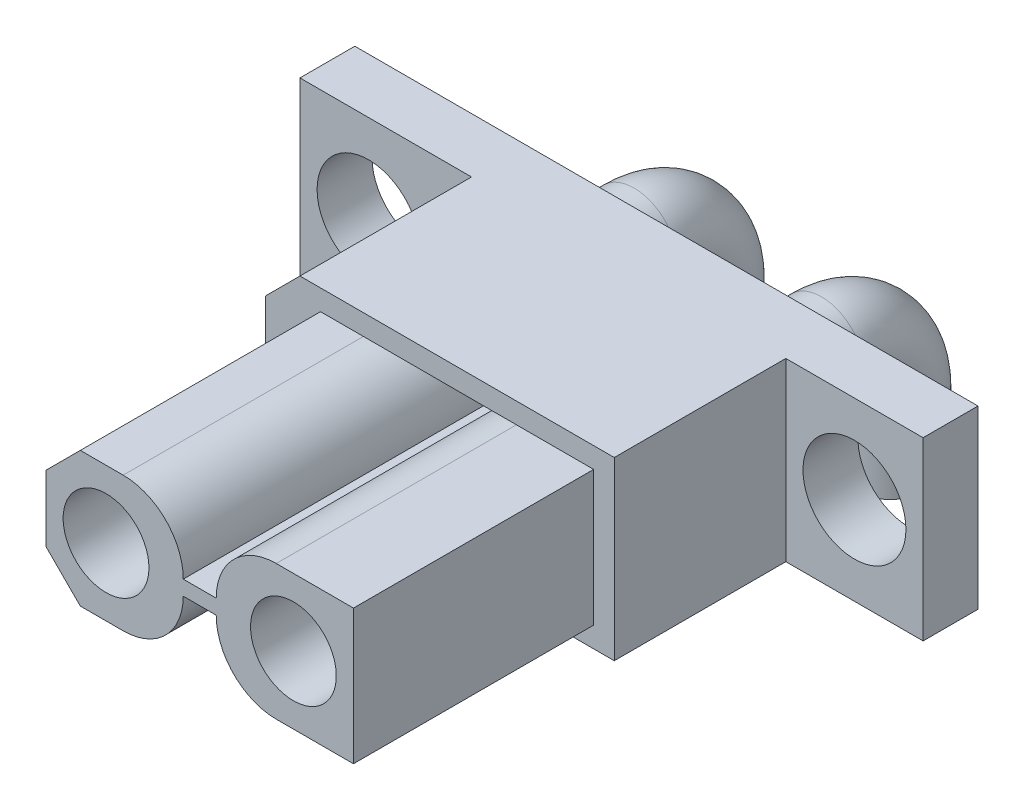
from build123d import *

# Parameters (mm, degrees)
EXTRUDE_1_DEPTH     = 5
EXTRUDE_2_DEPTH     = 9
SKETCH_12_R         = 1.25
CUT_EXTRUDE_3_DEPTH = 7
SKETCH_13_R         = 1.25
EXTRUDE_3_DEPTH     = 5.5
SKETCH_14_OUTSIDE_W = 15.846
SKETCH_14_OUTSIDE_H = 10.816
CUT_EXTRUDE_4_DEPTH = 2
EXTRUDE_4_DEPTH     = 0.2
SKETCH_16_W         = 18.16
SKETCH_16_H         = 5.13
EXTRUDE_5_DEPTH     = 1.6
SKETCH_17_R         = 1.5
CUT_EXTRUDE_5_DEPTH = 1.6
SKETCH_21_W         = 18.16
SKETCH_21_H         = 0.1
CUT_EXTRUDE_6_DEPTH = 19
SKETCH_22_R         = 1.25
SKETCH_22_R_2       = 1.264973269


with BuildPart() as part:
    # 草图1 → 凸台-拉伸1 (new body)
    with BuildSketch(Plane.XY):
        Polygon((-5.08, 1.565), (-4.08, 2.565), (5.08, 2.565), (5.08, -2.565), (-4.08, -2.565), (-5.08, -1.565), align=None)
        with BuildLine():
            Line((-2.58, 1.965), (4.48, 1.965))
            Line((4.48, 1.965), (4.48, -1.965))
            Line((4.48, -1.965), (-2.58, -1.965))
            ThreePointArc((-2.58, -1.965), (-3.923502884, -1.408502884), (-4.48, -0.065))
            Line((-4.48, -0.065), (-4.48, 0.065))
            ThreePointArc((-4.48, 0.065), (-3.923502884, 1.408502884), (-2.58, 1.965))
        make_face(mode=Mode.SUBTRACT)
    extrude(amount=EXTRUDE_1_DEPTH)

    # 草图11 → 凸台-拉伸2 (add)
    with BuildSketch(Plane.XY.offset(12)):
        with BuildLine():
            Line((4.48, 1.965), (2.23, 1.965))
            ThreePointArc((2.23, 1.965), (0.992563133, 1.452436867), (0.48, 0.215))
            Line((0.48, 0.215), (-0.48, 0.215))
            ThreePointArc((-0.48, 0.215), (-0.992563133, 1.452436867), (-2.23, 1.965))
            Line((-2.23, 1.965), (-3.48, 1.965))
            Line((-3.48, 1.965), (-4.48, 0.965))
            Line((-4.48, 0.965), (-4.48, -0.965))
            Line((-4.48, -0.965), (-3.48, -1.965))
            Line((-3.48, -1.965), (-2.23, -1.965))
            ThreePointArc((-2.23, -1.965), (-0.992563133, -1.452436867), (-0.48, -0.215))
            Line((-0.48, -0.215), (0.48, -0.215))
            ThreePointArc((0.48, -0.215), (0.992563133, -1.452436867), (2.23, -1.965))
            Line((2.23, -1.965), (4.48, -1.965))
            Line((4.48, -1.965), (4.48, 1.965))
        make_face()
    extrude(amount=-EXTRUDE_2_DEPTH)

    # 草图12 → 切除-拉伸3 (cut)
    with BuildSketch(Plane.XY.offset(12)):
        with Locations((-2.73, 0)):
            Circle(SKETCH_12_R)
        with Locations(Location((2.73, 0, 0), (0, 0, 180))):
            Circle(SKETCH_12_R)
    extrude(amount=-CUT_EXTRUDE_3_DEPTH, mode=Mode.SUBTRACT)

    # 草图13 → 凸台-拉伸3 (add)
    with BuildSketch(Plane(origin=(0, 0, 3), x_dir=(-1, 0, 0), z_dir=(0, 0, -1))):
        with Locations((-2.73, 0)):
            Circle(SKETCH_13_R)
        with Locations(Location((2.73, 0, 0), (0, 0, 180))):
            Circle(SKETCH_13_R)
    extrude(amount=EXTRUDE_3_DEPTH)

    # 草图14 outside → 切除-拉伸4 (cut)
    with BuildSketch(Plane(origin=(0, 0, -2.5), x_dir=(-1, 0, 0), z_dir=(0, 0, -1))):
        Rectangle(SKETCH_14_OUTSIDE_W, SKETCH_14_OUTSIDE_H)
        with BuildLine():
            Line((2.73, 1.25), (2.73, 1.05))
            ThreePointArc((2.73, 1.05), (1.68, 0), (2.73, -1.05))
            Line((2.73, -1.05), (2.73, -1.25))
            ThreePointArc((2.73, -1.25), (1.48, 0), (2.73, 1.25))
        make_face(mode=Mode.SUBTRACT)
        with BuildLine():
            Line((-2.73, -1.05), (-2.73, -1.25))
            ThreePointArc((-2.73, -1.25), (-1.48, 0), (-2.73, 1.25))
            Line((-2.73, 1.25), (-2.73, 1.05))
            ThreePointArc((-2.73, 1.05), (-1.68, 0), (-2.73, -1.05))
        make_face(mode=Mode.SUBTRACT)
    extrude(amount=-CUT_EXTRUDE_4_DEPTH, mode=Mode.SUBTRACT)

    # 草图15 → 凸台-拉伸4 (add)
    # profile 1 of 4: a face of its own
    with BuildSketch(Plane.XZ.offset(2.565)):
        with BuildLine():
            Line((-1.041373299, 2.763608723), (-0.788700651, 3.345297607))
            add(Edge.make_bspline(
                [(-0.788700651, 3.345297607), (-0.785699855, 3.352832574), (-0.779086641, 3.369438279), (-0.769283297, 3.397216489), (-0.758520307, 3.430083634), (-0.747450957, 3.466499495), (-0.735715633, 3.50256431), (-0.726848101, 3.535477496), (-0.718701877, 3.562609392), (-0.71070132, 3.591684523), (-0.703226848, 3.624912706), (-0.700446885, 3.651289728), (-0.699058503, 3.664463057)],
                knots=[0, 0, 0, 0, 0.732180493, 1.613593324, 2.658872914, 3.854365511, 5.049858108, 6.082130019, 6.931166509, 7.607179292, 8.804966943, 10, 10, 10, 10], degree=3))
            Line((-0.699058503, 3.664463057), (-0.692162953, 3.721105073))
            Line((-0.692162953, 3.721105073), (-0.652267272, 3.727508084))
            Line((-0.652267272, 3.727508084), (-0.59907303, 3.448238315))
            add(Edge.make_bspline(
                [(-0.59907303, 3.448238315), (-0.606236158, 3.441112758), (-0.619094907, 3.428321454), (-0.636002073, 3.408729798), (-0.651397164, 3.388573808), (-0.666367072, 3.369706677), (-0.679699995, 3.34705483), (-0.692653326, 3.320482788), (-0.708466151, 3.284616869), (-0.719497962, 3.257495386), (-0.725655624, 3.242356898)],
                knots=[0, 0, 0, 0, 0.993153163, 1.782839525, 2.541730564, 3.487713786, 4.146615727, 5.1212284, 6.393146485, 8, 8, 8, 8], degree=3))
            Line((-0.725655624, 3.242356898), (-0.995074607, 2.634070894))
            Line((-0.995074607, 2.634070894), (-0.659162822, 1.782963027))
            Line((-0.659162822, 1.782963027), (-0.59267002, 1.610081742))
            add(Edge.make_bspline(
                [(-0.59267002, 1.610081742), (-0.585877659, 1.595003907), (-0.573723185, 1.568023136), (-0.565734982, 1.534357688), (-0.562368546, 1.512769383), (-0.562386064, 1.501555349), (-0.563251809, 1.493246832), (-0.568012268, 1.487124536), (-0.575227878, 1.485075384), (-0.58375205, 1.479453616), (-0.59690259, 1.489441184), (-0.609618657, 1.502953197), (-0.622197636, 1.518674757), (-0.630091958, 1.527518978), (-0.632565701, 1.530290379)],
                knots=[0, 0, 0, 0, 2.761412339, 4.941361911, 5.773257577, 6.405449525, 6.825913753, 7.139309286, 7.63100465, 8.075064367, 8.689683572, 10.011329248, 11.37683553, 12, 12, 12, 12], degree=3))
            Line((-0.632565701, 1.530290379), (-0.715804839, 1.603186192))
            add(Edge.make_bspline(
                [(-0.715804839, 1.603186192), (-0.722615527, 1.608499588), (-0.734649115, 1.617887658), (-0.749202322, 1.631250342), (-0.758896637, 1.640300109), (-0.765959919, 1.649365925), (-0.763806594, 1.664252463), (-0.764372864, 1.685443646), (-0.762967622, 1.715390793), (-0.766857911, 1.737372102), (-0.76899908, 1.749470357)],
                knots=[0, 0, 0, 0, 1.23478745, 2.181706523, 2.812113369, 3.150477244, 3.760922406, 4.816942161, 6.248082283, 8, 8, 8, 8], degree=3))
            add(Edge.make_bspline(
                [(-0.76899908, 1.749470357), (-0.770950519, 1.760638029), (-0.774542554, 1.781194488), (-0.77933531, 1.807198258), (-0.784685487, 1.830176303), (-0.793096562, 1.853909423), (-0.803743136, 1.885709392), (-0.817318423, 1.922335086), (-0.8305059, 1.958761868), (-0.841521292, 1.98962364), (-0.849188276, 2.012027154), (-0.853542802, 2.024146208), (-0.855193453, 2.028740125)],
                knots=[0, 0, 0, 0, 1.161118987, 2.137284709, 2.708267813, 3.575038829, 4.713036419, 6.143931784, 7.57482715, 8.681074464, 9.500040603, 10, 10, 10, 10], degree=3))
            Line((-0.855193453, 2.028740125), (-1.048268849, 2.517339086))
            Line((-1.048268849, 2.517339086), (-1.367434299, 1.749470357))
            Line((-1.367434299, 1.749470357), (-1.447225662, 1.566738286))
            add(Edge.make_bspline(
                [(-1.447225662, 1.566738286), (-1.453431806, 1.553692141), (-1.464640861, 1.530129213), (-1.479943326, 1.503545173), (-1.492627404, 1.489781406), (-1.497797187, 1.482926786), (-1.505128669, 1.481397423), (-1.506253636, 1.485082253), (-1.506822914, 1.486946923)],
                knots=[0, 0, 0, 0, 2.381178734, 4.300699059, 5.010137615, 5.450112729, 5.721735305, 6, 6, 6, 6], degree=3))
            add(Edge.make_bspline(
                [(-1.506822914, 1.486946923), (-1.508064506, 1.487860915), (-1.511781969, 1.490597505), (-1.514192361, 1.49967567), (-1.516292172, 1.511280307), (-1.515219855, 1.523415036), (-1.514606876, 1.535697518), (-1.514184578, 1.549172544), (-1.513557335, 1.56656861), (-1.51366121, 1.579379008), (-1.513718464, 1.586439857)],
                knots=[0, 0, 0, 0, 0.356334141, 1.066903249, 2.083622437, 3.166508591, 3.901872409, 4.984758563, 6.338055839, 8, 8, 8, 8], degree=3))
            Line((-1.513718464, 1.586439857), (-1.506822914, 1.719425461))
            add(Edge.make_bspline(
                [(-1.506822914, 1.719425461), (-1.506291274, 1.729942416), (-1.505359526, 1.748374321), (-1.502637861, 1.772328742), (-1.50077189, 1.789043394), (-1.496723047, 1.803475802), (-1.484737728, 1.817277532), (-1.468675761, 1.834551372), (-1.451388323, 1.852407698), (-1.437059666, 1.870389417), (-1.425313426, 1.889250824), (-1.413589346, 1.906715589), (-1.402019805, 1.925490574), (-1.392033474, 1.947227083), (-1.3792598, 1.974905102), (-1.365402268, 2.007207681), (-1.3514663, 2.039721608), (-1.33904694, 2.068737149), (-1.329476606, 2.092405121), (-1.323303812, 2.106083348), (-1.320643068, 2.111979263)],
                knots=[0, 0, 0, 0, 1.283891209, 2.250134334, 2.938194825, 3.337125035, 4.054003749, 5.116665614, 6.235914532, 7.077065651, 7.915591523, 8.942962049, 9.643436631, 10.601555545, 11.855913542, 13.362341093, 14.887150874, 16.17010505, 17.211235183, 18, 18, 18, 18], degree=3))
            Line((-1.320643068, 2.111979263), (-1.098015316, 2.640473905))
            Line((-1.098015316, 2.640473905), (-1.350687964, 3.328551271))
            add(Edge.make_bspline(
                [(-1.350687964, 3.328551271), (-1.359064527, 3.346937636), (-1.377248525, 3.386851093), (-1.40033464, 3.437690551), (-1.419789319, 3.479024772), (-1.432824723, 3.506431603), (-1.445163266, 3.528223829), (-1.460131998, 3.551004739), (-1.478730386, 3.577896398), (-1.492925369, 3.599737405), (-1.500419903, 3.611268815)],
                knots=[0, 0, 0, 0, 1.512108789, 3.282513405, 4.178459187, 4.931286787, 5.553090324, 6.050678811, 6.970815613, 8, 8, 8, 8], degree=3))
            Line((-1.500419903, 3.611268815), (-1.52997226, 3.651164496))
            Line((-1.52997226, 3.651164496), (-1.513718464, 3.700910963))
            Line((-1.513718464, 3.700910963), (-1.317195293, 3.631462925))
            add(Edge.make_bspline(
                [(-1.317195293, 3.631462925), (-1.316319191, 3.618332857), (-1.314720387, 3.594371739), (-1.313190021, 3.559294693), (-1.308612869, 3.522933417), (-1.302512171, 3.488728319), (-1.294412549, 3.455599358), (-1.285265275, 3.425669351), (-1.27468829, 3.391474793), (-1.265776342, 3.367744568), (-1.261045816, 3.355148392)],
                knots=[0, 0, 0, 0, 1.113815777, 2.032607081, 2.970224408, 4.213083212, 4.971379877, 5.85514338, 6.861494526, 8, 8, 8, 8], degree=3))
            Line((-1.261045816, 3.355148392), (-1.041373299, 2.763608723))
        make_face()
    # profile 2 of 4: a face of its own
    with BuildSketch(Plane.XZ.offset(2.565)):
        with BuildLine():
            Line((0.143183657, 3.684657167), (0.179631563, 3.684657167))
            Line((0.179631563, 3.684657167), (0.176183788, 1.918903867))
            add(Edge.make_bspline(
                [(0.176183788, 1.918903867), (0.175791022, 1.902979513), (0.175037936, 1.872446337), (0.174976817, 1.828761281), (0.173540121, 1.789208515), (0.173425688, 1.75373141), (0.172357384, 1.722376313), (0.171121994, 1.695136663), (0.171004608, 1.6719614), (0.168819423, 1.635689122), (0.166215485, 1.585817445), (0.159757854, 1.534450465), (0.154617095, 1.497849342), (0.149391089, 1.481187871), (0.142770276, 1.46800477), (0.136162717, 1.469542162), (0.133332871, 1.470200588)],
                knots=[0, 0, 0, 0, 1.45038606, 2.780953852, 3.977268029, 5.053718292, 6.010937745, 6.833690271, 7.536464333, 8.120251454, 10.142880859, 12.069479857, 12.873132744, 13.440417135, 13.76034519, 14, 14, 14, 14], degree=3))
            add(Edge.make_bspline(
                [(0.133332871, 1.470200588), (0.132678701, 1.47069575), (0.129878693, 1.472815163), (0.123201451, 1.477301183), (0.115267509, 1.489326224), (0.111794525, 1.500114301), (0.109690986, 1.506648494)],
                knots=[0, 0, 0, 0, 0.221265066, 0.947068446, 2.150880552, 4, 4, 4, 4], degree=3))
            Line((0.109690986, 1.506648494), (0.09343719, 1.54999195))
            Line((0.09343719, 1.54999195), (0.056496744, 1.669678994))
            add(Edge.make_bspline(
                [(0.056496744, 1.669678994), (0.052049911, 1.680940312), (0.044303758, 1.700556946), (0.036489599, 1.726365352), (0.030561514, 1.74284511), (0.028985877, 1.75620267), (0.036575728, 1.768732097), (0.042165393, 1.788023595), (0.050766394, 1.812647922), (0.058888685, 1.8417113), (0.066062584, 1.873113822), (0.072525016, 1.907043259), (0.076187461, 1.945270452), (0.077984033, 1.981769396), (0.079362795, 2.016910226), (0.079613295, 2.050741057), (0.080304207, 2.090797795), (0.080196274, 2.119695267), (0.080138629, 2.135128609)],
                knots=[0, 0, 0, 0, 1.220359697, 2.125803599, 2.712350858, 2.994193817, 3.439826662, 4.12562012, 5.031064022, 6.063176816, 7.167225426, 8.277459231, 9.542238136, 11.034069985, 11.961482632, 13.08703073, 14.444263491, 16, 16, 16, 16], degree=3))
            Line((0.080138629, 2.135128609), (0.083093865, 3.43838753))
            Line((0.083093865, 3.43838753), (-0.08978742, 3.28865559))
            Line((-0.08978742, 3.28865559), (-0.103085981, 3.345297607))
            add(Edge.make_bspline(
                [(-0.103085981, 3.345297607), (-0.089033172, 3.359818446), (-0.062690602, 3.387038357), (-0.027485252, 3.426230137), (0.001469916, 3.460242395), (0.031628656, 3.500004317), (0.065394807, 3.549487782), (0.090330043, 3.590142199), (0.103287975, 3.611268815)],
                knots=[0, 0, 0, 0, 1.077185482, 2.019228619, 2.808185376, 3.45765616, 4.678836699, 6, 6, 6, 6], degree=3))
            Line((0.103287975, 3.611268815), (0.143183657, 3.684657167))
        make_face()
    # profile 3 of 4: a face of its own
    with BuildSketch(Plane.XZ.offset(2.565)):
        with BuildLine():
            add(Edge.make_bspline(
                [(1.277994146, 2.876400217), (1.28537217, 2.891673891), (1.299584969, 2.921096627), (1.32031567, 2.963596906), (1.339655524, 3.002617496), (1.356196936, 3.038826248), (1.371621051, 3.071424885), (1.385358222, 3.100762386), (1.397228063, 3.126848343), (1.409724499, 3.15580934), (1.422685212, 3.186022381), (1.435232271, 3.215615282), (1.444356639, 3.236754174), (1.449073957, 3.247937092), (1.450875431, 3.252207684)],
                knots=[0, 0, 0, 0, 1.475873638, 2.843077615, 4.114458223, 5.26483622, 6.306479236, 7.252326145, 8.083448402, 8.799989154, 9.996708352, 10.943956596, 11.596712522, 12, 12, 12, 12], degree=3))
            Line((1.450875431, 3.252207684), (1.557263914, 3.534925227))
            add(Edge.make_bspline(
                [(1.557263914, 3.534925227), (1.534125167, 3.532660835), (1.483637562, 3.527720042), (1.419206481, 3.523797042), (1.365634345, 3.520940163), (1.328874701, 3.517859861), (1.296685722, 3.51498079), (1.276841945, 3.512790409), (1.267650821, 3.511775882)],
                knots=[0, 0, 0, 0, 1.440114021, 3.142257811, 3.998086789, 4.76330671, 5.427195687, 6, 6, 6, 6], degree=3))
            Line((1.267650821, 3.511775882), (1.168157887, 3.495029546))
            add(Edge.make_bspline(
                [(1.168157887, 3.495029546), (1.163712274, 3.494094929), (1.151583427, 3.491545039), (1.129153443, 3.484582077), (1.096850124, 3.476019241), (1.072262894, 3.46897744), (1.058321629, 3.46498465)],
                knots=[0, 0, 0, 0, 0.478461291, 1.305373098, 2.472113022, 4, 4, 4, 4], degree=3))
            Line((1.058321629, 3.46498465), (1.025321498, 3.45168609))
            Line((1.025321498, 3.45168609), (0.94208236, 3.574820909))
            add(Edge.make_bspline(
                [(0.94208236, 3.574820909), (0.938567449, 3.579641896), (0.93256712, 3.587871837), (0.927585778, 3.599320513), (0.923888193, 3.607274184), (0.927202228, 3.615283541), (0.940306898, 3.614082524), (0.950201123, 3.607057785), (0.962838814, 3.600299083), (0.977378761, 3.599348513), (0.995006325, 3.598314017), (1.007925785, 3.600321952), (1.014978173, 3.60141803)],
                knots=[0, 0, 0, 0, 1.323589942, 2.259509366, 2.829398404, 3.190947808, 3.965341466, 5.19662492, 6.050472624, 7.088782, 8.410843841, 10, 10, 10, 10], degree=3))
            Line((1.014978173, 3.60141803), (1.121366656, 3.604865804))
            Line((1.121366656, 3.604865804), (1.540517579, 3.654612271))
            Line((1.540517579, 3.654612271), (1.57351771, 3.684657167))
            Line((1.57351771, 3.684657167), (1.600114831, 3.711254288))
            add(Edge.make_bspline(
                [(1.600114831, 3.711254288), (1.600939686, 3.710272413), (1.604321133, 3.706247269), (1.611600782, 3.696669241), (1.624545017, 3.681280854), (1.634331434, 3.668456994), (1.640010513, 3.661015282)],
                knots=[0, 0, 0, 0, 0.23984028, 0.983211964, 2.249351781, 4, 4, 4, 4], degree=3))
            Line((1.640010513, 3.661015282), (1.703548079, 3.581223919))
            add(Edge.make_bspline(
                [(1.703548079, 3.581223919), (1.707814727, 3.575684248), (1.71490522, 3.566478192), (1.72016552, 3.551755059), (1.714775321, 3.541779796), (1.707245539, 3.533229187), (1.69503972, 3.52295925), (1.685368986, 3.515812774), (1.679906194, 3.511775882)],
                knots=[0, 0, 0, 0, 1.419029252, 2.358201718, 2.827787952, 3.596253847, 4.642174893, 6, 6, 6, 6], degree=3))
            Line((1.679906194, 3.511775882), (1.643458287, 3.481730986))
            add(Edge.make_bspline(
                [(1.643458287, 3.481730986), (1.632806603, 3.454961791), (1.612596528, 3.404171001), (1.583477814, 3.331886934), (1.556833001, 3.267616008), (1.533437009, 3.210796919), (1.511947461, 3.162075471), (1.49420657, 3.120734131), (1.478233993, 3.087566689), (1.468464329, 3.068151144), (1.464173991, 3.059624827)],
                knots=[0, 0, 0, 0, 1.507300768, 2.859891598, 4.076963614, 5.147345159, 6.074452096, 6.862861548, 7.500626815, 8, 8, 8, 8], degree=3))
            Line((1.464173991, 3.059624827), (1.364188519, 2.869997207))
            add(Edge.make_bspline(
                [(1.364188519, 2.869997207), (1.376007123, 2.870940852), (1.398641836, 2.8727481), (1.433185204, 2.876198047), (1.470822188, 2.871452675), (1.503833079, 2.858250382), (1.531919585, 2.841959763), (1.554425307, 2.825688638), (1.575926131, 2.804540728), (1.597850362, 2.779679815), (1.619825807, 2.750007025), (1.640026837, 2.714067184), (1.66105585, 2.673027099), (1.687355055, 2.610482667), (1.715772465, 2.526796942), (1.733038421, 2.421687202), (1.741569125, 2.316378054), (1.742821494, 2.246294642), (1.74344376, 2.211472196)],
                knots=[0, 0, 0, 0, 0.660541429, 1.265053373, 1.928435853, 2.750244091, 3.225390118, 3.735570922, 4.291687282, 4.900607759, 5.580848831, 6.342918567, 7.193367346, 8.147740655, 10.119512469, 12.097611575, 14.061014616, 16, 16, 16, 16], degree=3))
            add(Edge.make_bspline(
                [(1.74344376, 2.211472196), (1.742129276, 2.18420994), (1.739632177, 2.132420407), (1.733597281, 2.059237822), (1.724591456, 1.995034012), (1.711476013, 1.922649784), (1.688345968, 1.842679457), (1.659771733, 1.768899444), (1.632640928, 1.715745144), (1.60977569, 1.680498855), (1.584731733, 1.648966545), (1.557818734, 1.621372355), (1.529823663, 1.598695722), (1.502653166, 1.579193075), (1.475159382, 1.565409237), (1.439566217, 1.553894204), (1.396070518, 1.54595682), (1.361428065, 1.544366601), (1.344486948, 1.54358894)],
                knots=[0, 0, 0, 0, 1.512752116, 2.8737433, 4.067977017, 5.104892351, 6.948544146, 8.672095895, 9.482011449, 10.251829035, 10.996496654, 11.710742831, 12.38300564, 12.991319199, 13.561044299, 14.079002633, 15.060579187, 16, 16, 16, 16], degree=3))
            add(Edge.make_bspline(
                [(1.344486948, 1.54358894), (1.330036896, 1.543342632), (1.302236654, 1.542868764), (1.261913132, 1.546151407), (1.225187269, 1.553664775), (1.190744509, 1.563885562), (1.158487747, 1.580048553), (1.127676301, 1.603137325), (1.096659054, 1.631568491), (1.066919723, 1.666458727), (1.039701881, 1.706431383), (1.015903317, 1.750646601), (0.996129987, 1.798478424), (0.976472803, 1.866549685), (0.959811672, 1.9535928), (0.956843447, 2.024062608), (0.955380921, 2.058785021)],
                knots=[0, 0, 0, 0, 0.828828519, 1.594571005, 2.314948186, 2.97625877, 3.650192192, 4.371738268, 5.178272596, 6.059897072, 6.995131469, 7.947518938, 8.935744196, 9.957858231, 12.008325587, 14, 14, 14, 14], degree=3))
            Line((0.955380921, 2.058785021), (0.951933146, 2.18832285))
            Line((0.951933146, 2.18832285), (0.988381052, 2.18832285))
            add(Edge.make_bspline(
                [(0.988381052, 2.18832285), (0.991168175, 2.169113421), (0.996505763, 2.13232566), (1.004269898, 2.07925027), (1.012311437, 2.030868456), (1.021374026, 1.9736132), (1.036467478, 1.909321723), (1.061895342, 1.840127311), (1.096379088, 1.781662398), (1.136867251, 1.733483298), (1.18422057, 1.698512423), (1.234913082, 1.67645352), (1.286577902, 1.666038254), (1.320809189, 1.666167738), (1.337591398, 1.666231219)],
                knots=[0, 0, 0, 0, 0.994021113, 1.903638599, 2.746793397, 3.505624798, 4.871908371, 6.122639036, 7.264652637, 8.331625701, 9.323760524, 10.250011688, 11.142051883, 12, 12, 12, 12], degree=3))
            add(Edge.make_bspline(
                [(1.337591398, 1.666231219), (1.351092433, 1.667395449), (1.377535343, 1.669675691), (1.415880432, 1.678356811), (1.451341927, 1.693169477), (1.484491377, 1.712111651), (1.514329189, 1.736812898), (1.541183381, 1.765919032), (1.563925446, 1.800496422), (1.589412895, 1.853432408), (1.614182783, 1.926411657), (1.632820157, 2.019108076), (1.644947802, 2.113660884), (1.650645303, 2.207740464), (1.651421617, 2.300425186), (1.643800389, 2.361084451), (1.640010513, 2.391249032)],
                knots=[0, 0, 0, 0, 0.647840119, 1.268849254, 1.871153999, 2.479976942, 3.088343857, 3.716462885, 4.367721208, 5.059616847, 6.52246665, 8.039623249, 9.575767262, 11.078710543, 12.547304005, 14, 14, 14, 14], degree=3))
            add(Edge.make_bspline(
                [(1.640010513, 2.391249032), (1.634711144, 2.423762004), (1.624235512, 2.488032667), (1.600003352, 2.565176296), (1.576141434, 2.622781237), (1.554852459, 2.661429568), (1.530722337, 2.695951672), (1.503389047, 2.72490587), (1.475680759, 2.74866598), (1.447869027, 2.764520509), (1.420403476, 2.772678908), (1.402804177, 2.77088524), (1.394233414, 2.770011734)],
                knots=[0, 0, 0, 0, 2.019199264, 3.991492233, 4.943861116, 5.841091039, 6.693606335, 7.520378909, 8.278781735, 8.923571305, 9.475785111, 10, 10, 10, 10], degree=3))
            Line((1.394233414, 2.770011734), (1.341039173, 2.763608723))
            Line((1.341039173, 2.763608723), (1.317889827, 2.720265267))
            add(Edge.make_bspline(
                [(1.317889827, 2.720265267), (1.314800013, 2.714863593), (1.309413708, 2.705447149), (1.30205338, 2.693000731), (1.296174778, 2.685710578), (1.291712786, 2.67942593), (1.285262604, 2.681540094), (1.281113837, 2.688764461), (1.27448165, 2.699399742), (1.270167473, 2.708533896), (1.267650821, 2.713862256)],
                knots=[0, 0, 0, 0, 1.659028505, 2.892093886, 3.763458346, 4.288089223, 4.647361994, 5.327919393, 6.441255868, 8, 8, 8, 8], degree=3))
            Line((1.267650821, 2.713862256), (1.214456579, 2.816802965))
            add(Edge.make_bspline(
                [(1.214456579, 2.816802965), (1.210611596, 2.822719332), (1.203908694, 2.833033248), (1.206814583, 2.844790256), (1.208053569, 2.849803096)],
                knots=[0, 0, 0, 0, 1.147259222, 2, 2, 2, 2], degree=3))
            Line((1.208053569, 2.849803096), (1.234650689, 2.860146421))
            Line((1.234650689, 2.860146421), (1.277994146, 2.876400217))
        make_face()
    # profile 4 of 4: a face of its own
    with BuildSketch(Plane.XZ.offset(2.565)):
        with BuildLine():
            add(Edge.make_bspline(
                [(2.133042327, 2.647369454), (2.134647417, 2.679232962), (2.137935947, 2.744515319), (2.146875777, 2.844577751), (2.160062318, 2.948966076), (2.175353678, 3.056170837), (2.1965128, 3.162074148), (2.223592515, 3.262787317), (2.258161933, 3.355905343), (2.292656805, 3.42740806), (2.321817202, 3.479832966), (2.343034175, 3.514707276), (2.363219169, 3.546157961), (2.383106021, 3.573482787), (2.402625031, 3.596750512), (2.420626512, 3.616925603), (2.438794, 3.632632881), (2.461578661, 3.648208088), (2.489312504, 3.66209952), (2.521450839, 3.674251995), (2.552374945, 3.681281816), (2.572520476, 3.681232959), (2.582238145, 3.681209392)],
                knots=[0, 0, 0, 0, 1.583211401, 3.243703523, 4.983978234, 6.804605119, 8.6166428, 10.340282122, 11.974804003, 13.53820457, 14.274983449, 14.951299633, 15.563740824, 16.129235462, 16.626851747, 17.070813204, 17.469389546, 17.815167281, 18.438300608, 19.002855301, 19.519003895, 20, 20, 20, 20], degree=3))
            add(Edge.make_bspline(
                [(2.582238145, 3.681209392), (2.591530445, 3.679584527), (2.611157229, 3.676152558), (2.640173625, 3.66339183), (2.670970349, 3.646421494), (2.703736452, 3.624426432), (2.736450289, 3.59485288), (2.766768207, 3.555683565), (2.794914615, 3.507846787), (2.829892431, 3.432137707), (2.868436801, 3.329519201), (2.898701649, 3.221771245), (2.918360751, 3.131806714), (2.931181631, 3.060029557), (2.941376282, 2.98391713), (2.952323721, 2.876917858), (2.962086825, 2.739808667), (2.963660338, 2.629328452), (2.964448622, 2.573981102)],
                knots=[0, 0, 0, 0, 0.36369769, 0.768186139, 1.217229854, 1.724510149, 2.290946358, 2.914777825, 3.632489608, 4.433551378, 6.137860108, 7.866765886, 8.757390638, 9.699141408, 10.686159515, 11.726895222, 13.859299765, 16, 16, 16, 16], degree=3))
            add(Edge.make_bspline(
                [(2.964448622, 2.573981102), (2.961433425, 2.529631878), (2.955236565, 2.438484971), (2.940494592, 2.298889815), (2.916181038, 2.15366768), (2.885585514, 2.031338976), (2.85599203, 1.933939156), (2.830895731, 1.863656359), (2.802815743, 1.797284318), (2.772845668, 1.735466256), (2.741667439, 1.680436873), (2.709393263, 1.634196254), (2.675289236, 1.598581675), (2.640251824, 1.572999702), (2.606042289, 1.555663173), (2.573355246, 1.544578438), (2.542227257, 1.538425588), (2.52200304, 1.539584845), (2.512297568, 1.540141165)],
                knots=[0, 0, 0, 0, 1.760488992, 3.618172134, 5.557361062, 7.587083219, 8.607294374, 9.588398617, 10.541277716, 11.460251193, 12.307925722, 13.044175775, 13.687957546, 14.251129358, 14.754223989, 15.200440537, 15.616296545, 16, 16, 16, 16], degree=3))
            add(Edge.make_bspline(
                [(2.512297568, 1.540141165), (2.503023719, 1.541444748), (2.483484435, 1.544191296), (2.454031879, 1.555749095), (2.42336094, 1.573556552), (2.390617603, 1.597030439), (2.357646873, 1.629280042), (2.325898002, 1.67099268), (2.29545126, 1.722395008), (2.266516772, 1.782506432), (2.23934023, 1.849460326), (2.215543742, 1.921704612), (2.193496768, 1.997621335), (2.175831205, 2.076996258), (2.161294315, 2.157217408), (2.149888402, 2.236071158), (2.141885329, 2.312635021), (2.137566279, 2.386603625), (2.13605602, 2.457411533), (2.134459891, 2.524394148), (2.13346137, 2.587277029), (2.133178569, 2.6278318), (2.133042327, 2.647369454)],
                knots=[0, 0, 0, 0, 0.451175502, 0.950591959, 1.515271951, 2.162531354, 2.891688268, 3.734081857, 4.687580886, 5.773002708, 6.954198864, 8.17563603, 9.445923076, 10.771603705, 12.101713585, 13.383756751, 14.619631726, 15.819374781, 16.961914306, 18.040825747, 19.056148764, 20, 20, 20, 20], degree=3))
        make_face()
        with BuildLine():
            add(Edge.make_bspline(
                [(2.219729239, 2.640473905), (2.219378722, 2.624549202), (2.218634392, 2.590732781), (2.21792651, 2.536873103), (2.219247111, 2.476941806), (2.221503583, 2.388503957), (2.229787962, 2.272926786), (2.250961325, 2.134171061), (2.281200938, 1.999797165), (2.31452226, 1.894499508), (2.345544155, 1.819436802), (2.369349029, 1.772850182), (2.394392618, 1.735214546), (2.420630713, 1.706547176), (2.447171198, 1.686231068), (2.471974262, 1.67171361), (2.49547825, 1.661744848), (2.511230252, 1.660444767), (2.518700579, 1.659828208)],
                knots=[0, 0, 0, 0, 0.705717407, 1.498604912, 2.386138873, 3.361274458, 5.418191474, 7.514713171, 9.57394393, 11.515405308, 12.398906158, 13.169972934, 13.829695216, 14.395845116, 14.883250105, 15.303691084, 15.669778158, 16, 16, 16, 16], degree=3))
            add(Edge.make_bspline(
                [(2.518700579, 1.659828208), (2.525616424, 1.659917159), (2.540471566, 1.660108224), (2.563713132, 1.665697421), (2.588146851, 1.677462865), (2.615249332, 1.692923687), (2.643092345, 1.716718308), (2.670573896, 1.749236369), (2.69750996, 1.790912018), (2.724373643, 1.840192149), (2.749784738, 1.895019171), (2.772547733, 1.953106456), (2.792357638, 2.013068753), (2.813782219, 2.096960061), (2.835807721, 2.205763847), (2.855591656, 2.338631045), (2.868711699, 2.469657086), (2.874175505, 2.576549278), (2.875695328, 2.661160578), (2.874432267, 2.728490756), (2.872049216, 2.800743141), (2.8693206, 2.850628239), (2.867910924, 2.876400217)],
                knots=[0, 0, 0, 0, 0.308126263, 0.661851094, 1.055455993, 1.515432549, 2.051181639, 2.679899785, 3.409545513, 4.262246801, 5.183512362, 6.104777924, 7.045624675, 8.000099589, 9.967578284, 11.997814557, 13.993544283, 15.842664909, 16.77344086, 17.770161498, 18.848005724, 20, 20, 20, 20], degree=3))
            add(Edge.make_bspline(
                [(2.867910924, 2.876400217), (2.865535495, 2.900543316), (2.860924819, 2.947404722), (2.852818906, 3.01513045), (2.842760342, 3.077986273), (2.82858709, 3.155423331), (2.805707744, 3.248340028), (2.774193061, 3.336799529), (2.747012014, 3.403587292), (2.723649129, 3.445903644), (2.699887232, 3.48181543), (2.673481786, 3.509220649), (2.647779094, 3.530576529), (2.623588062, 3.546537979), (2.600993555, 3.557807527), (2.585778556, 3.560353153), (2.57879037, 3.561522348)],
                knots=[0, 0, 0, 0, 1.302834758, 2.528783491, 3.662347304, 4.720685654, 6.75648594, 8.792057095, 9.759925264, 10.624039914, 11.384659521, 12.06448684, 12.659424566, 13.175428451, 13.621277708, 14, 14, 14, 14], degree=3))
            add(Edge.make_bspline(
                [(2.57879037, 3.561522348), (2.571193854, 3.560969559), (2.555230869, 3.559807951), (2.530861926, 3.552338436), (2.504997301, 3.540658581), (2.47658144, 3.524457257), (2.446980244, 3.498454333), (2.417090941, 3.460391426), (2.386163291, 3.409903505), (2.353883105, 3.347752924), (2.323040236, 3.274527227), (2.296835217, 3.190653776), (2.274190628, 3.097551483), (2.257134168, 2.997845269), (2.243355965, 2.898055537), (2.232612823, 2.804258551), (2.224382553, 2.719377686), (2.221220998, 2.665768867), (2.219729239, 2.640473905)],
                knots=[0, 0, 0, 0, 0.347392606, 0.729995465, 1.156884588, 1.644891073, 2.219813456, 2.945627096, 3.849684979, 4.924243867, 6.145708801, 7.477723151, 8.938118981, 10.524254447, 12.100980159, 13.544449593, 14.841364989, 16, 16, 16, 16], degree=3))
        make_face(mode=Mode.SUBTRACT)
    extrude(amount=EXTRUDE_4_DEPTH)

    # 草图16 → 凸台-拉伸5 (add)
    with BuildSketch(Plane(origin=(0, 0, 0), x_dir=(-1, 0, 0), z_dir=(0, 0, -1))):
        Rectangle(SKETCH_16_W, SKETCH_16_H)
    extrude(amount=EXTRUDE_5_DEPTH)

    # 草图17 → 切除-拉伸5 (cut)
    with BuildSketch(Plane.XY):
        with Locations((7.08, 0)):
            Circle(SKETCH_17_R)
    cut_extrude_5 = extrude(amount=-CUT_EXTRUDE_5_DEPTH, mode=Mode.SUBTRACT)

    # 镜向1: 切除-拉伸5 across plane
    add(cut_extrude_5.mirror(Plane(origin=(0, 0, 0), x_dir=(0, 0, 1), z_dir=(1, 0, 0))), mode=Mode.SUBTRACT)

    # 草图21 → 切除-拉伸6 (cut)
    with BuildSketch(Plane(origin=(0, 2.565, 0), x_dir=(1, 0, 0), z_dir=(0, 1, 0))):
        with Locations((0, 1.65)):
            Rectangle(SKETCH_21_W, SKETCH_21_H)
    extrude(amount=-CUT_EXTRUDE_6_DEPTH, mode=Mode.SUBTRACT)


with BuildPart() as cut_extrude_6_piece_1:
    # of the separate pieces the step leaves, piece 1, a body of its own (cut_extrude_6_pieces)
    add(part.part.solids().sort_by_distance((-5.08, 1.565, 0))[0])



with BuildPart() as cut_extrude_6_piece_2:
    # of the separate pieces the step leaves, piece 2, a body of its own (cut_extrude_6_pieces)
    add(part.part.solids().sort_by_distance((2.73, -1.05, -2.5))[0])


with BuildPart() as cut_extrude_6_piece_3:
    # of the separate pieces the step leaves, piece 3, a body of its own (cut_extrude_6_pieces)
    add(part.part.solids().sort_by_distance((-2.73, 1.25, -2.5))[0])


with BuildPart() as cut_extrude_6_piece_1_1:
    add(cut_extrude_6_piece_1.part)

    add(cut_extrude_6_piece_2.part)  # 扫描1 merges 切除-拉伸6 piece 2

    add(cut_extrude_6_piece_3.part)  # 扫描1 merges 切除-拉伸6 piece 3
    # 扫描1: sweep along a path in 草图23
    with BuildLine(Plane(origin=(0, 0, 0), x_dir=(0, 0, -1), z_dir=(1, 0, 0))) as sweep_1_path:
        Line((1.6, 0), (3.39099596, 0))
        ThreePointArc((3.39099596, 0), (4.805209523, -0.585786438), (5.39099596, -2))
        Line((5.39099596, -2), (5.39099596, -3.981226792))
    # 草图22 → 扫描1 (sweep)
    with BuildSketch(Plane(origin=(0, 0, -1.6), x_dir=(-1, 0, 0), z_dir=(0, 0, -1))):
        with Locations((-2.73, 0)):
            Circle(SKETCH_22_R)
        with Locations((2.73, 0)):
            Circle(SKETCH_22_R_2)
    sweep(path=sweep_1_path.line)


solid = cut_extrude_6_piece_1_1.part
